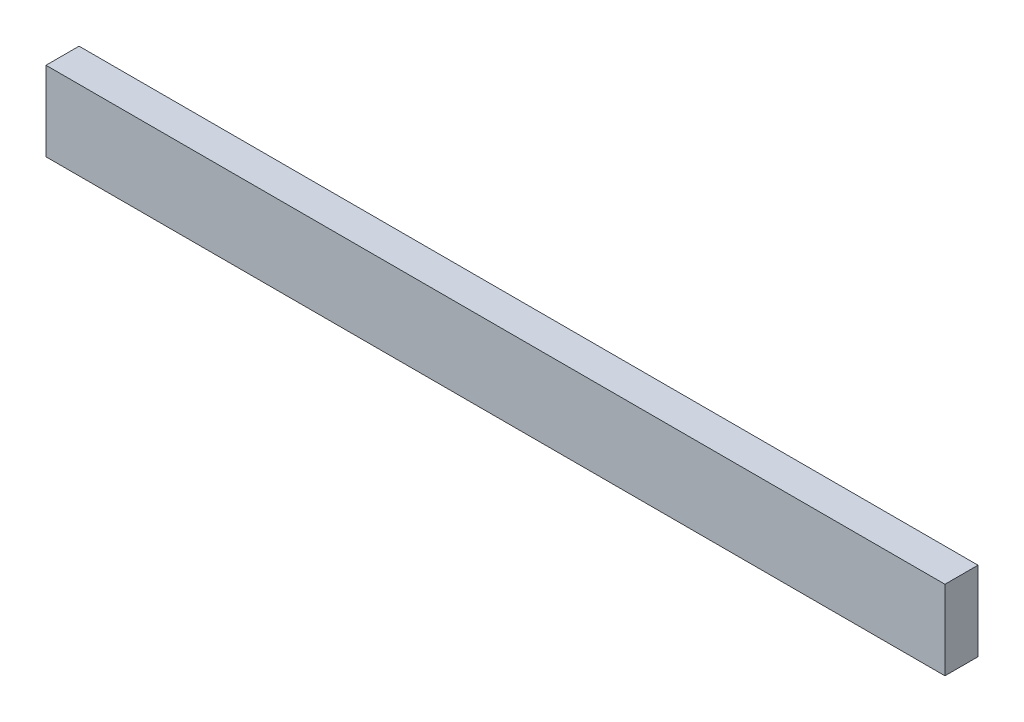
from build123d import *

# Parameters (mm, degrees)
ESQUISSE1_W        = 680
ESQUISSE1_H        = 60
BOSS_EXTRU_1_DEPTH = 25


with BuildPart() as part:
    # Esquisse1 → Boss.-Extru.1 (new body)
    with BuildSketch(Plane.XY):
        with Locations((340, 30)):
            Rectangle(ESQUISSE1_W, ESQUISSE1_H)
    extrude(amount=BOSS_EXTRU_1_DEPTH)


solid = part.part
